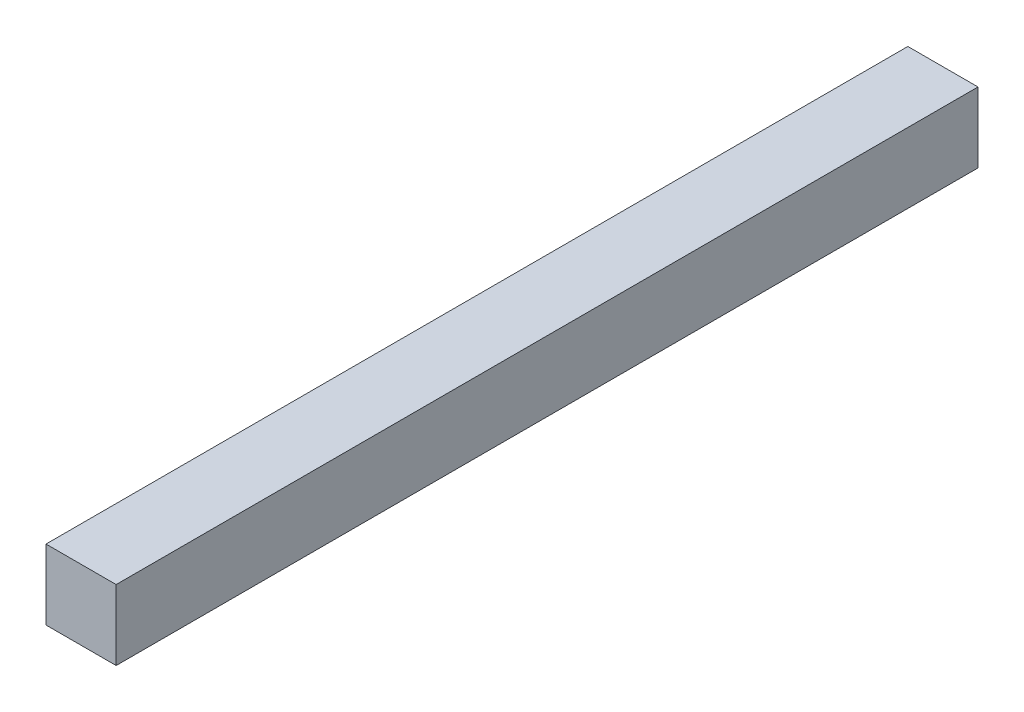
from build123d import *

# Parameters (mm, degrees)
ESQUISSE1_W             = 70
ESQUISSE1_H             = 70
BOSS_EXTRU_1_DEPTH      = 860
ESQUISSE2_R             = 6
ENL_V_MAT_EXTRU_1_DEPTH = 80


with BuildPart() as part:
    # Esquisse1 → Boss.-Extru.1 (new body)
    with BuildSketch(Plane.XY):
        with Locations((35, 35)):
            Rectangle(ESQUISSE1_W, ESQUISSE1_H)
    extrude(amount=BOSS_EXTRU_1_DEPTH)

    # Esquisse2 → Enlèv. mat.-Extru.1 (cut)
    with BuildSketch(Plane(origin=(0, 0, 0), x_dir=(-1, 0, 0), z_dir=(0, 0, -1))):
        with Locations((-35, 35)):
            Circle(ESQUISSE2_R)
    extrude(amount=-ENL_V_MAT_EXTRU_1_DEPTH, mode=Mode.SUBTRACT)


solid = part.part
